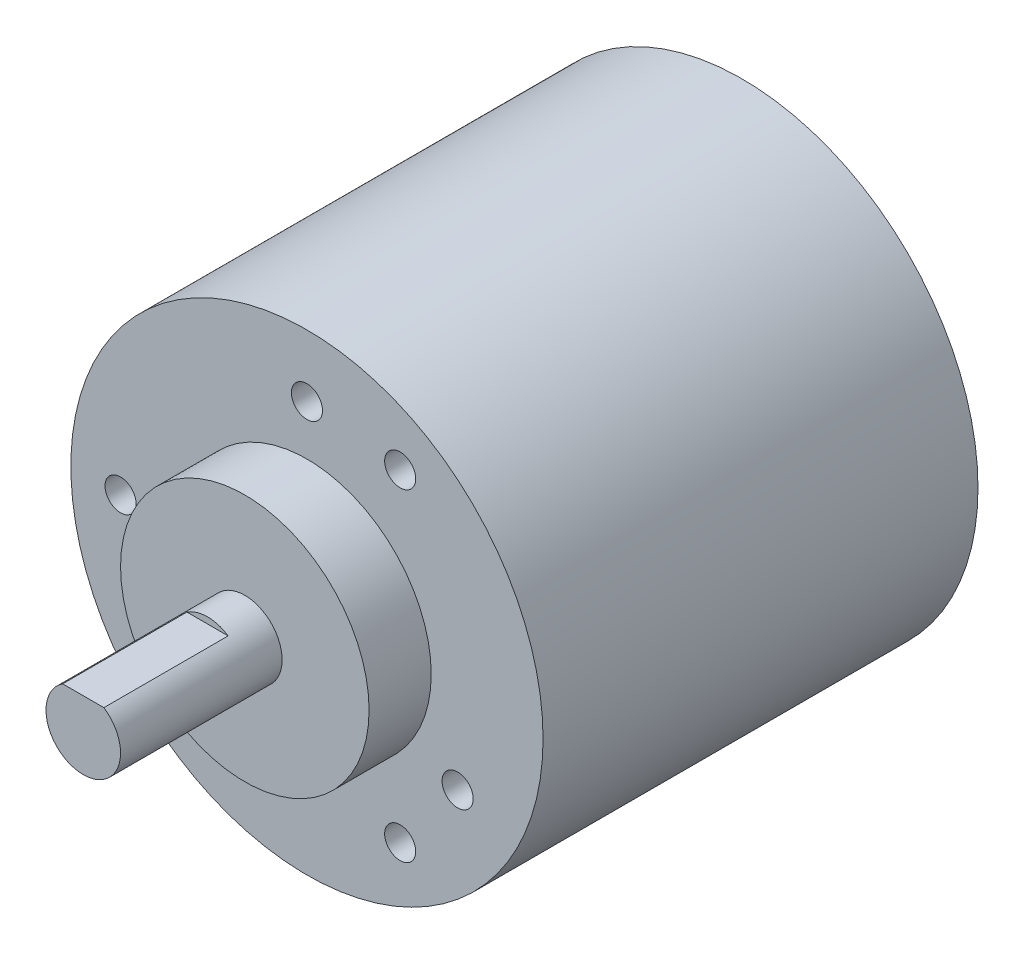
from build123d import *

# Parameters (mm, degrees)
SKETCH1_R                 = 19
BOSS_EXTRUDE1_DEPTH       = 35
BOSS_EXTRUDE2_START       = 35
SKETCH2_R                 = 10
BOSS_EXTRUDE2_DEPTH       = 5
BOSS_EXTRUDE3_START       = 40
SKETCH3_R                 = 3
BOSS_EXTRUDE3_DEPTH       = 13
CUT_EXTRUDE1_START        = -10
CUT_EXTRUDE1_DEPTH        = 10
M3X0_5_TAPPED_HOLE1_D     = 2.5
M3X0_5_TAPPED_HOLE1_DEPTH = 7.5
M3X0_5_TAPPED_HOLE1_TIP   = 0.751075774


with BuildPart() as part:
    # Sketch1 → Boss-Extrude1 (new body)
    with BuildSketch(Plane.XY):
        Circle(SKETCH1_R)
    extrude(amount=BOSS_EXTRUDE1_DEPTH)

    # Sketch2 → Boss-Extrude2 (add)
    with BuildSketch(Plane.XY.offset(BOSS_EXTRUDE2_START)):
        Circle(SKETCH2_R)
    extrude(amount=BOSS_EXTRUDE2_DEPTH)

    # Sketch3 → Boss-Extrude3 (add)
    with BuildSketch(Plane.XY.offset(BOSS_EXTRUDE3_START)):
        with Locations(Location((0, 0, 0), (0, 0, 180))):
            Circle(SKETCH3_R)
    extrude(amount=BOSS_EXTRUDE3_DEPTH)

    # Sketch4 → Cut-Extrude1 (cut)
    with BuildSketch(Plane.XY.offset(53).offset(CUT_EXTRUDE1_START)):
        with BuildLine():
            Line((-1.658312395, 2.5), (1.658312395, 2.5))
            ThreePointArc((1.658312395, 2.5), (0, 3), (-1.658312395, 2.5))
        make_face()
    extrude(amount=CUT_EXTRUDE1_DEPTH, mode=Mode.SUBTRACT)

    # M3x0.5 Tapped Hole1
    with Locations(Plane.XY.offset(35)):
        with Locations((0, 14), (7.5, 12.990381057), (12.124355653, -7), (7.5, -12.990381057), (-12.124355653, -7), (-15, 0)):
            Hole(M3X0_5_TAPPED_HOLE1_D / 2, depth=M3X0_5_TAPPED_HOLE1_DEPTH)
            with Locations((0, 0, -(M3X0_5_TAPPED_HOLE1_DEPTH + M3X0_5_TAPPED_HOLE1_TIP / 2))):  # 118° drill point
                Cone(0, M3X0_5_TAPPED_HOLE1_D / 2, M3X0_5_TAPPED_HOLE1_TIP, mode=Mode.SUBTRACT)


solid = part.part
